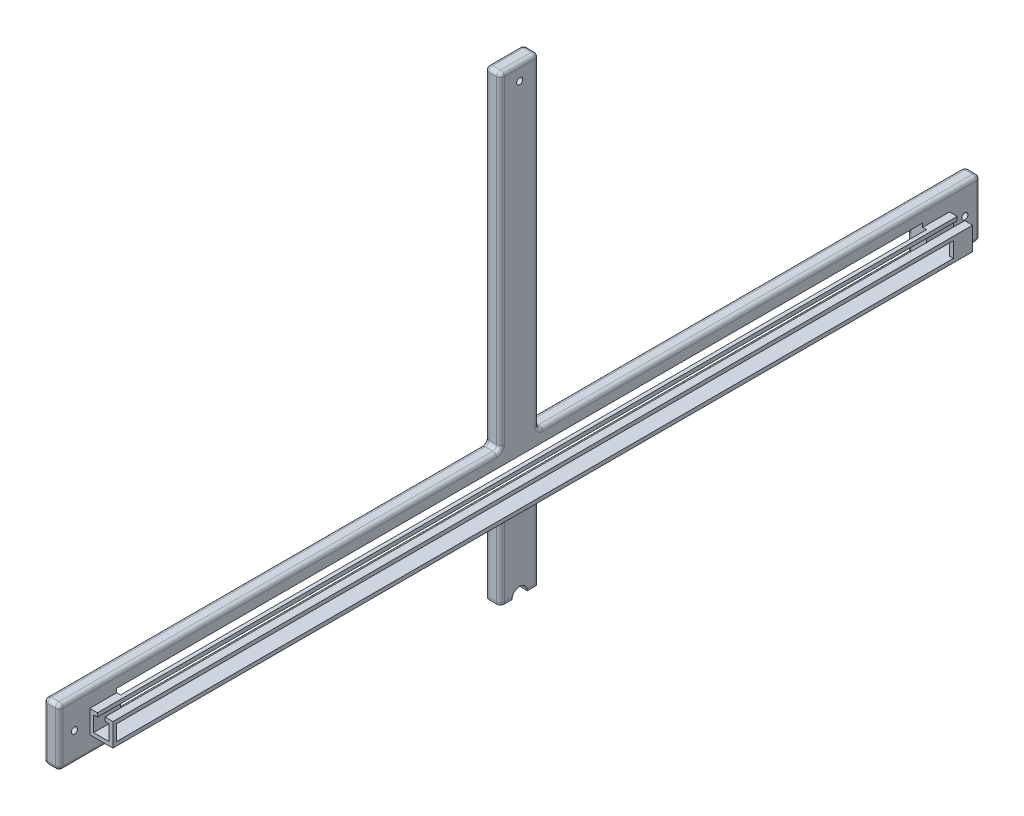
from build123d import *

# Parameters (mm, degrees)
BOSS_EXTRUDE1_DEPTH     = 4
CUT_EXTRUDE1_DEPTH      = 4
CUT_EXTRUDE1_DEPTH_BACK = 4
SKETCH4_R               = 0.8
SKETCH4_R_2             = 2
FILLET1_R               = 1
BOSS_EXTRUDE5_DEPTH     = 224
SKETCH9_W               = 218
SKETCH9_H               = 4
CUT_EXTRUDE2_DEPTH      = 2
SKETCH11_W              = 210
SKETCH11_H              = 8
CUT_EXTRUDE3_DEPTH      = 5
FILLET4_R               = 1
SKETCH12_R              = 2
CUT_EXTRUDE4_DEPTH      = 5


with BuildPart() as part:
    # Sketch3 → Boss-Extrude1 (new body)
    with BuildSketch(Plane(origin=(0, 0, 0), x_dir=(0, 0, -1), z_dir=(1, 0, 0))):
        Polygon((-151.031128477, 38.486176731), (-36.031128477, 38.486176731), (-36.031128477, 23.486176731), (-151.031128477, 23.486176731), (-151.031128477, 3.486176731), (-161.031128477, 3.486176731), (-161.031128477, 23.486176731), (-276.031128477, 23.486176731), (-276.031128477, 38.486176731), (-161.031128477, 38.486176731), (-161.031128477, 123.486176731), (-151.031128477, 123.486176731), align=None)
    extrude(amount=BOSS_EXTRUDE1_DEPTH)

    # Sketch4 → Cut-Extrude1 (cut, two sides: drawn at the far end of the back side and taken through both)
    with BuildSketch(Plane(origin=(0, 0, 0), x_dir=(0, 0, -1), z_dir=(1, 0, 0)).offset(-CUT_EXTRUDE1_DEPTH_BACK)):
        with Locations((-156.031128477, 119.486176731)):
            Circle(SKETCH4_R)
        with Locations((-272.031128477, 30.986176731)):
            Circle(SKETCH4_R)
        with Locations((-40.031128477, 30.986176731)):
            Circle(SKETCH4_R)
        with Locations((-156.031128477, 30.986176731)):
            Circle(SKETCH4_R_2)
    extrude(amount=CUT_EXTRUDE1_DEPTH + CUT_EXTRUDE1_DEPTH_BACK, mode=Mode.SUBTRACT)

    # Fillet1
    fillet1_edges = [part.edges().sort_by_distance(p)[0] for p in [
        (2, 123.486176731, 161.031128477),
        (2, 38.486176731, 161.031128477),
        (2, 38.486176731, 276.031128477),
        (2, 23.486176731, 276.031128477),
        (2, 23.486176731, 161.031128477),
        (2, 23.486176731, 151.031128477),
        (2, 23.486176731, 36.031128477),
        (2, 38.486176731, 36.031128477),
        (2, 38.486176731, 151.031128477),
        (2, 123.486176731, 151.031128477),
        (4, 80.986176731, 161.031128477),
        (4, 38.486176731, 218.531128477),
        (4, 30.986176731, 276.031128477),
        (4, 23.486176731, 218.531128477),
        (4, 13.486176731, 161.031128477),
        (4, 13.486176731, 151.031128477),
        (4, 23.486176731, 93.531128477),
        (4, 30.986176731, 36.031128477),
        (4, 38.486176731, 93.531128477),
        (4, 80.986176731, 151.031128477),
        (4, 123.486176731, 156.031128477),
        (0, 80.986176731, 161.031128477),
        (0, 38.486176731, 218.531128477),
        (0, 30.986176731, 276.031128477),
        (0, 23.486176731, 218.531128477),
        (0, 13.486176731, 161.031128477),
        (0, 13.486176731, 151.031128477),
        (0, 23.486176731, 93.531128477),
        (0, 30.986176731, 36.031128477),
        (0, 38.486176731, 93.531128477),
        (0, 80.986176731, 151.031128477),
        (0, 123.486176731, 156.031128477),
    ]]
    fillet(fillet1_edges, radius=FILLET1_R)

    # Sketch7 → Boss-Extrude5 (add)
    with BuildSketch(Plane.XY.offset(268.031128477)):
        Polygon((6, 33.986176731), (6, 32.986176731), (5, 32.986176731), (5, 28.986176731), (9, 28.986176731), (9, 32.986176731), (7.983095202, 32.986176731), (7.983095202, 34.023219581), (10, 33.986176731), (10, 27.986176731), (4, 27.986176731), (4, 33.986176731), align=None)
    extrude(amount=-BOSS_EXTRUDE5_DEPTH)

    # Sketch9 → Cut-Extrude2 (cut)
    with BuildSketch(Plane(origin=(10, 0, 0), x_dir=(0, 0, -1), z_dir=(1, 0, 0))):
        with Locations((-158.031128477, 30.986176731)):
            Rectangle(SKETCH9_W, SKETCH9_H)
    extrude(amount=-CUT_EXTRUDE2_DEPTH, mode=Mode.SUBTRACT)


with BuildPart() as body_2:
    # Split1: the piece on the far side of the plane
    add(part.part)
    split(bisect_by=Plane(origin=(0, 3.986176731, 0), x_dir=(0, 0, -1), z_dir=(0, -1, 0)), keep=Keep.BOTTOM)

    # Sketch11 → Cut-Extrude3 (cut)
    with BuildSketch(Plane.ZY):
        with Locations((156.031128477, 30.986176731)):
            Rectangle(SKETCH11_W, SKETCH11_H)
    extrude(amount=-CUT_EXTRUDE3_DEPTH, mode=Mode.SUBTRACT)

    # Fillet4
    fillet4_edges = [body_2.edges().sort_by_distance(p)[0] for p in [
        (0, 30.986176731, 261.031128477),
        (0, 26.986176731, 156.031128477),
        (0, 34.986176731, 156.031128477),
        (0, 30.986176731, 51.031128477),
    ]]
    fillet(fillet4_edges, radius=FILLET4_R)


with BuildPart() as part_1:
    add(part.part)

    # Split1
    split(bisect_by=Plane(origin=(0, 3.986176731, 0), x_dir=(0, 0, -1), z_dir=(0, -1, 0)), keep=Keep.TOP)


with BuildPart() as cut_extrude4_tool:
    # Sketch12 → Cut-Extrude4 (new body)
    with BuildSketch(Plane.ZY):
        with Locations((156.031128477, 3.486176731)):
            Circle(SKETCH12_R)
    extrude(amount=-CUT_EXTRUDE4_DEPTH)


with BuildPart() as part_2:
    add(part_1.part)

    # Cut-Extrude4: cut by cut_extrude4_tool
    add(cut_extrude4_tool.part, mode=Mode.SUBTRACT)


with BuildPart() as body_2_1:
    add(body_2.part)

    # Cut-Extrude4: cut by cut_extrude4_tool
    add(cut_extrude4_tool.part, mode=Mode.SUBTRACT)


solid = Compound([part_2.part, body_2_1.part])
